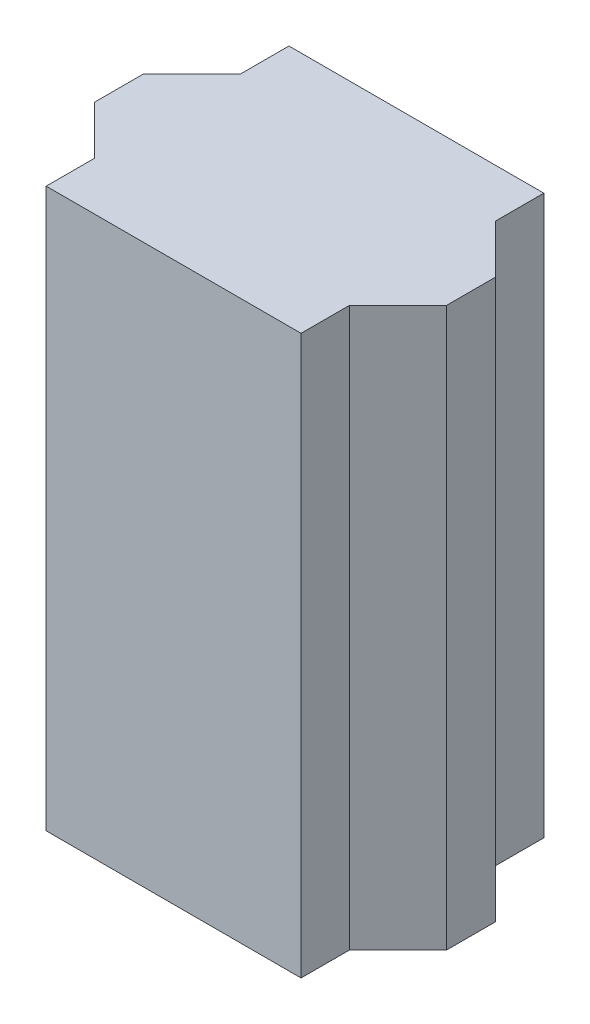
from build123d import *

# Parameters (mm, degrees)
EXTRUDE_1_DEPTH = 23


with BuildPart() as part:
    # Эскиз1 → Бобышка-Вытянуть1 (new body)
    with BuildSketch(Plane(origin=(0, 5, 0), x_dir=(1, 0, 0), z_dir=(0, 1, 0))):
        Polygon((-5.25, -28), (-5.25, -26), (-7.25, -24), (-7.25, -22), (-5.25, -20), (-5.25, -18), (5.25, -18), (5.25, -20), (7.25, -22), (7.25, -24), (5.25, -26), (5.25, -28), align=None)
    extrude(amount=EXTRUDE_1_DEPTH)


solid = part.part
